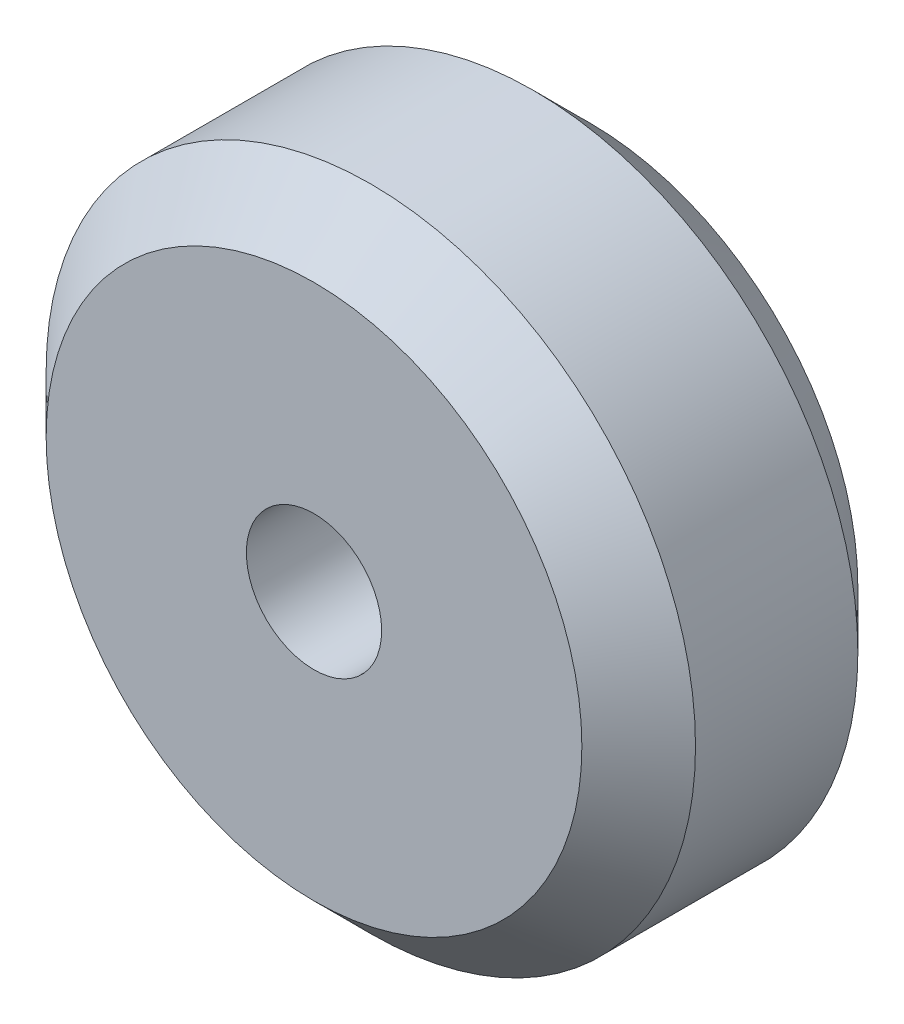
from build123d import *

# Parameters (mm, degrees)
SKETCH1_R           = 12
BOSS_EXTRUDE1_DEPTH = 10.2
SKETCH2_R           = 2.5
CUT_EXTRUDE1_DEPTH  = 20.8
CHAMFER1_SIZE       = 2.1
CHAMFER2_SIZE       = 2.1


with BuildPart() as part:
    # Sketch1 → Boss-Extrude1 (new body)
    with BuildSketch(Plane.XY):
        Circle(SKETCH1_R)
    extrude(amount=BOSS_EXTRUDE1_DEPTH)

    # Sketch2 → Cut-Extrude1 (cut, through all)
    with BuildSketch(Plane.XY.offset(10.2)):
        Circle(SKETCH2_R)
    extrude(amount=-CUT_EXTRUDE1_DEPTH, mode=Mode.SUBTRACT)

    # Chamfer1
    chamfer1_edges = [part.edges().sort_by_distance(p)[0] for p in [
        (-12, 0, 10.2),
    ]]
    chamfer(chamfer1_edges, length=CHAMFER1_SIZE)

    # Chamfer2
    chamfer2_edges = [part.edges().sort_by_distance(p)[0] for p in [
        (-12, 0, 0),
    ]]
    chamfer(chamfer2_edges, length=CHAMFER2_SIZE)


solid = part.part
